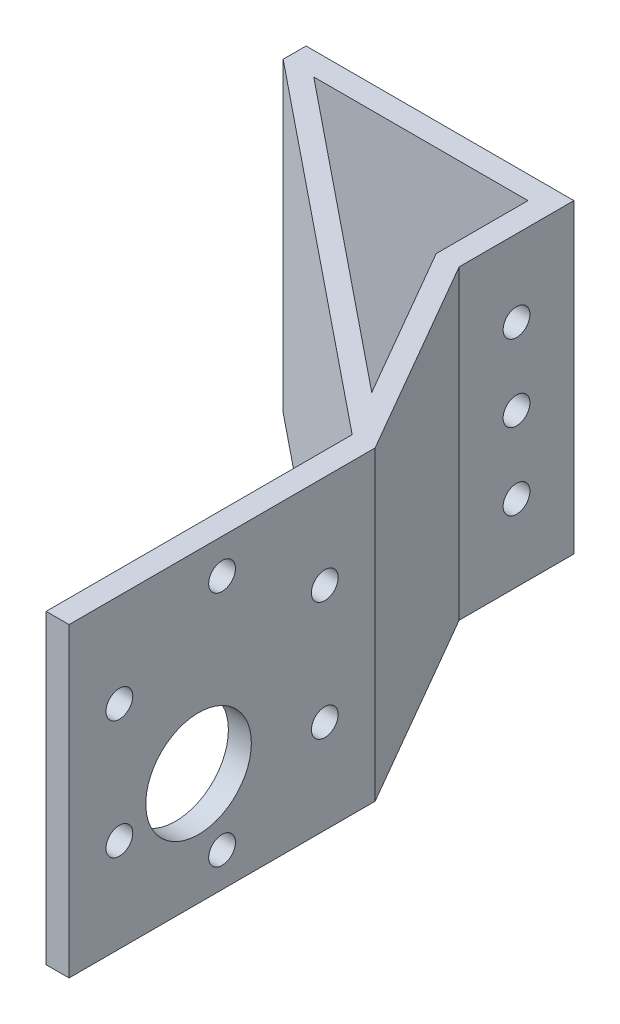
from build123d import *

# Parameters (mm, degrees)
Y_KSEKLIK_EKSTR_ZYON1_DEPTH = 40
IZIM3_R                     = 1.75
KES_EKSTR_ZYON2_DEPTH       = 3
IZIM4_R                     = 1.75
IZIM4_R_2                   = 6.898282176
KES_EKSTR_ZYON3_DEPTH       = 37


with BuildPart() as part:
    # Çizim1 → Yükseklik-Ekstrüzyon1 (new body)
    with BuildSketch(Plane(origin=(0, 0, 0), x_dir=(1, 0, 0), z_dir=(0, 1, 0))):
        Polygon((0, 0), (-35, 0), (-35, -3), (12, -40.980762114), (12, -80.980762114), (15, -80.980762114), (15, -40.980762114), (0, -15), align=None)
        Polygon((-3, -15), (-3, -3), (-31, -3), (8.501534624, -34.921242333), align=None, mode=Mode.SUBTRACT)
    extrude(amount=Y_KSEKLIK_EKSTR_ZYON1_DEPTH)

    # Çizim3 → Kes-Ekstrüzyon2 (cut)
    with BuildSketch(Plane(origin=(0, 0, 0), x_dir=(0, 0, -1), z_dir=(1, 0, 0))):
        with Locations((-7.5, 20)):
            Circle(IZIM3_R)
        with Locations((-7.5, 30)):
            Circle(IZIM3_R)
        with Locations((-7.5, 10)):
            Circle(IZIM3_R)
    extrude(amount=-KES_EKSTR_ZYON2_DEPTH, mode=Mode.SUBTRACT)

    # Çizim4 → Kes-Ekstrüzyon3 (cut)
    with BuildSketch(Plane(origin=(15, 0, 0), x_dir=(0, 0, -1), z_dir=(1, 0, 0))):
        with Locations((-60.980762114, 35.5)):
            Circle(IZIM4_R)
        with Locations((-47.557368355, 27.75)):
            Circle(IZIM4_R)
        with Locations((-47.557368355, 12.25)):
            Circle(IZIM4_R)
        with Locations((-60.980762114, 4.5)):
            Circle(IZIM4_R)
        with Locations((-74.404155872, 12.25)):
            Circle(IZIM4_R)
        with Locations((-74.404155872, 27.75)):
            Circle(IZIM4_R)
        with Locations((-64.054903201, 14.675431446)):
            Circle(IZIM4_R_2)
    extrude(amount=-KES_EKSTR_ZYON3_DEPTH, mode=Mode.SUBTRACT)


solid = part.part
